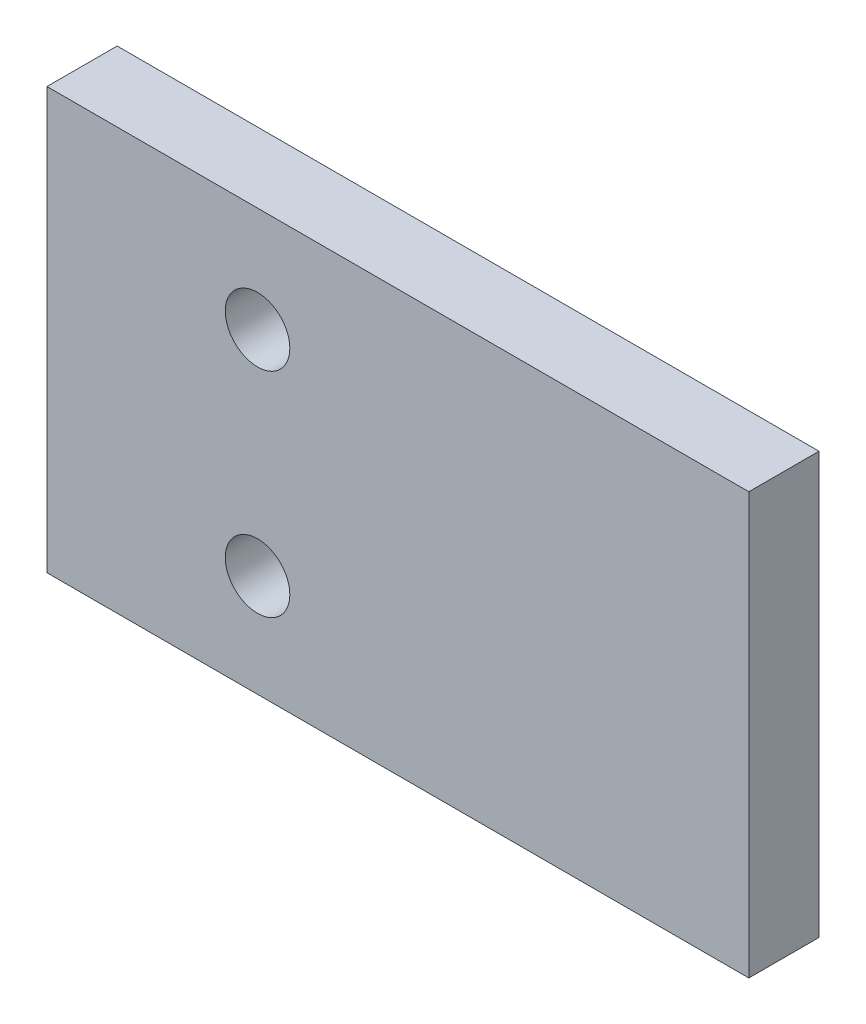
from build123d import *

# Parameters (mm, degrees)
SKETCH1_W           = 31.75
SKETCH1_H           = 19.05
BOSS_EXTRUDE1_DEPTH = 3.175
SKETCH2_R           = 1.4605
CUT_EXTRUDE1_DEPTH  = 9.525


with BuildPart() as part:
    # Sketch1 → Boss-Extrude1 (new body)
    with BuildSketch(Plane.XY):
        with Locations((200.025, 9.525)):
            Rectangle(SKETCH1_W, SKETCH1_H)
    extrude(amount=BOSS_EXTRUDE1_DEPTH)

    # Sketch2 → Cut-Extrude1 (cut)
    with BuildSketch(Plane.XY.offset(3.175)):
        with Locations((193.675, 14.2875)):
            Circle(SKETCH2_R)
        with Locations((193.675, 4.6355)):
            Circle(SKETCH2_R)
    extrude(amount=-CUT_EXTRUDE1_DEPTH, mode=Mode.SUBTRACT)


solid = part.part
